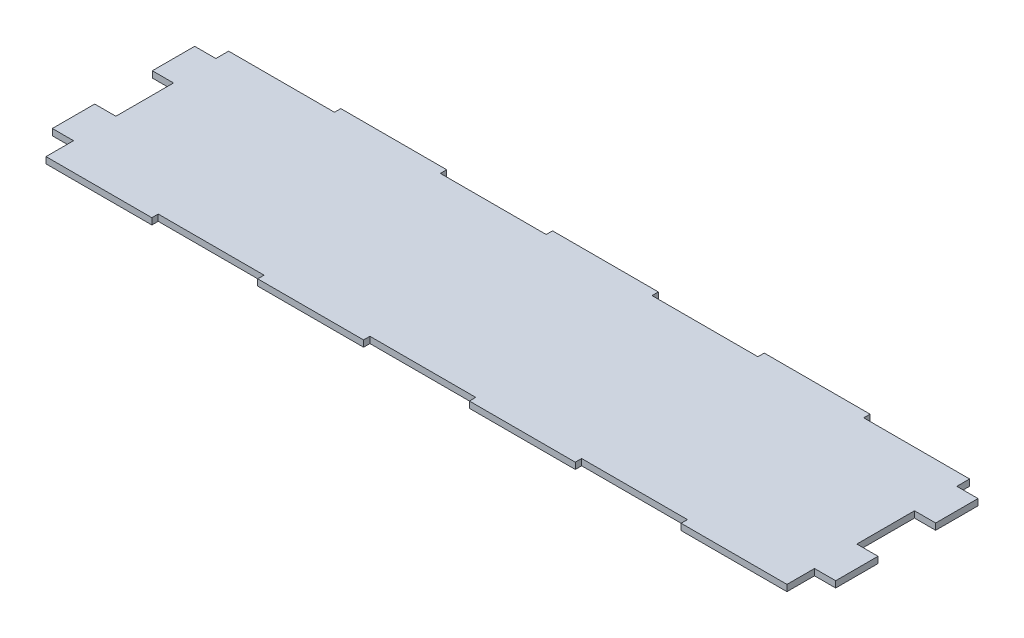
from build123d import *

# Parameters (mm, degrees)
EXTRUDE_1_DEPTH = 3


with BuildPart() as part:
    # 스케치1 → 보스-돌출1 (new body)
    with BuildSketch(Plane(origin=(0, 0, 0), x_dir=(1, 0, 0), z_dir=(0, 1, 0))):
        Polygon((-175, 3.97), (-175, 13.97), (-185, 13.97), (-185, 33.97), (-175, 33.97), (-175, 61.2), (-185, 61.2), (-185, 81.2), (-175, 81.2), (-175, 87.23), (-125, 87.23), (-125, 90.23), (-75, 90.23), (-75, 87.23), (-25, 87.23), (-25, 90.23), (25, 90.23), (25, 87.23), (75, 87.23), (75, 90.23), (125, 90.23), (125, 87.23), (175, 87.23), (175, 81.2), (185, 81.2), (185, 61.2), (175, 61.2), (175, 33.97), (185, 33.97), (185, 13.97), (175, 13.97), (175, 3.97), (175, 0.97), (125, 0.97), (125, 3.97), (75, 3.97), (75, 0.97), (25, 0.97), (25, 3.97), (-25, 3.97), (-25, 0.97), (-75, 0.97), (-75, 3.97), (-125, 3.97), (-125, 0.97), (-175, 0.97), align=None)
    extrude(amount=EXTRUDE_1_DEPTH)


solid = part.part
